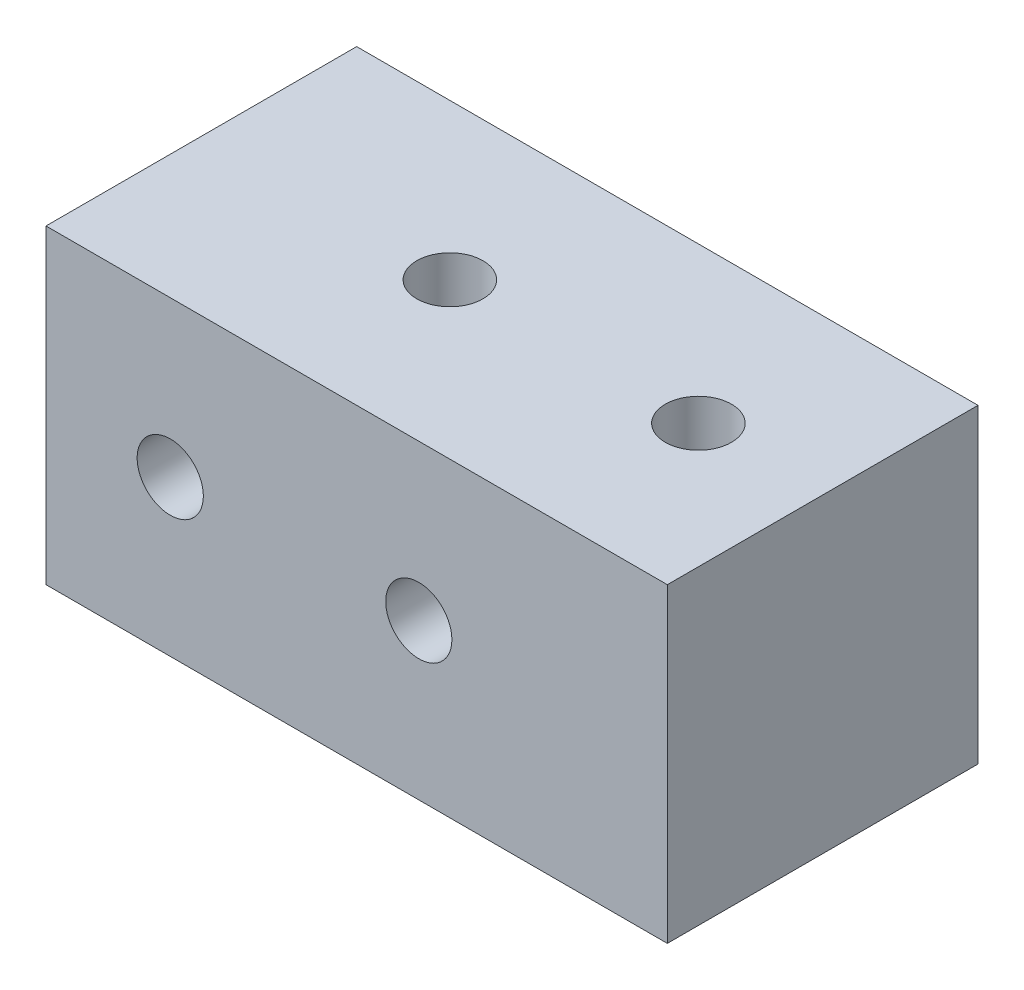
from build123d import *

# Parameters (mm, degrees)
SKETCH1_W                 = 25.4
SKETCH1_H                 = 12.7
BOSS_EXTRUDE1_DEPTH       = 12.7
TAP_DRILL_FOR_6_32_TAP1_D = 2.7051
TAP_DRILL_FOR_6_32_TAP2_D = 2.7051


with BuildPart() as part:
    # Sketch1 → Boss-Extrude1 (new body)
    with BuildSketch(Plane.XY):
        Rectangle(SKETCH1_W, SKETCH1_H)
    extrude(amount=BOSS_EXTRUDE1_DEPTH)

    # Tap Drill for #6-32 Tap1 (through all)
    with Locations(Plane(origin=(0, 6.35, 0), x_dir=(1, 0, 0), z_dir=(0, 1, 0))):
        with Locations((-2.54, -6.35), (7.62, -6.35)):
            Hole(TAP_DRILL_FOR_6_32_TAP1_D / 2)

    # Tap Drill for #6-32 Tap2 (through all)
    with Locations(Plane.XY.offset(12.7)):
        with Locations((-7.62, 0), (2.54, 0)):
            Hole(TAP_DRILL_FOR_6_32_TAP2_D / 2)


solid = part.part
